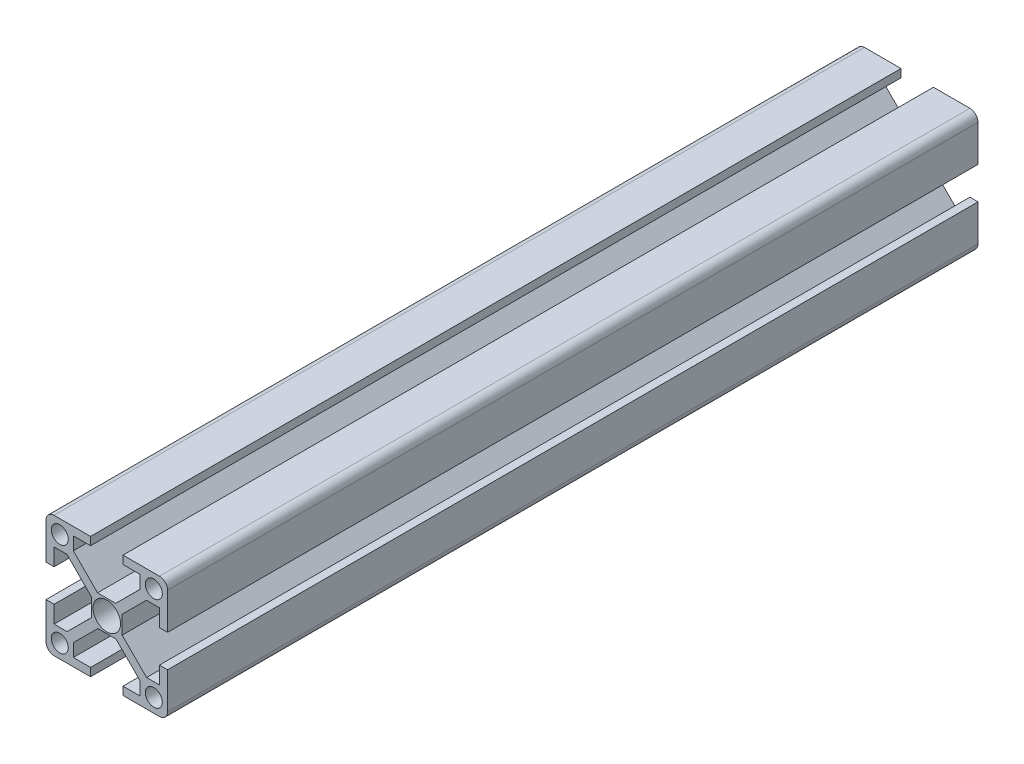
from build123d import *

# Parameters (mm, degrees)
SKETCH1_R           = 3.4
SKETCH1_R_2         = 2.1
BOSS_EXTRUDE1_DEPTH = 200
FILLET1_R           = 2


with BuildPart() as part:
    # Sketch1 → Boss-Extrude1 (new body)
    with BuildSketch(Plane.XY):
        Polygon((15, -15), (4, -15), (4, -13), (8.25, -13), (8.25, -9.793649234), (2.284159766, -3.8), (-2.204376468, -3.8), (-8.25, -9.817573384), (-8.25, -13), (-4, -13), (-4, -15), (-15, -15), (-15, -4), (-13, -4), (-13, -8.25), (-9.793649234, -8.25), (-3.8, -2.284159766), (-3.8, 2.204376468), (-9.817573384, 8.25), (-13, 8.25), (-13, 4), (-15, 4), (-15, 15), (-4, 15), (-4, 13), (-8.25, 13), (-8.25, 9.793649234), (-2.284159766, 3.8), (2.204376468, 3.8), (8.25, 9.817573384), (8.25, 13), (4, 13), (4, 15), (15, 15), (15, 4), (13, 4), (13, 8.25), (9.793649234, 8.25), (3.8, 2.284159766), (3.8, -2.204376468), (9.817573384, -8.25), (13, -8.25), (13, -4), (15, -4), align=None)
        Circle(SKETCH1_R, mode=Mode.SUBTRACT)
        with Locations((-11.6, 11.6)):
            Circle(SKETCH1_R_2, mode=Mode.SUBTRACT)
        with Locations((11.6, 11.6)):
            Circle(SKETCH1_R_2, mode=Mode.SUBTRACT)
        with Locations((11.6, -11.6)):
            Circle(SKETCH1_R_2, mode=Mode.SUBTRACT)
        with Locations((-11.6, -11.6)):
            Circle(SKETCH1_R_2, mode=Mode.SUBTRACT)
    extrude(amount=BOSS_EXTRUDE1_DEPTH)

    # Fillet1
    fillet1_edges = [part.edges().sort_by_distance(p)[0] for p in [
        (-15, -15, 100),
        (-15, 15, 100),
        (15, 15, 100),
        (15, -15, 100),
    ]]
    fillet(fillet1_edges, radius=FILLET1_R)


solid = part.part
